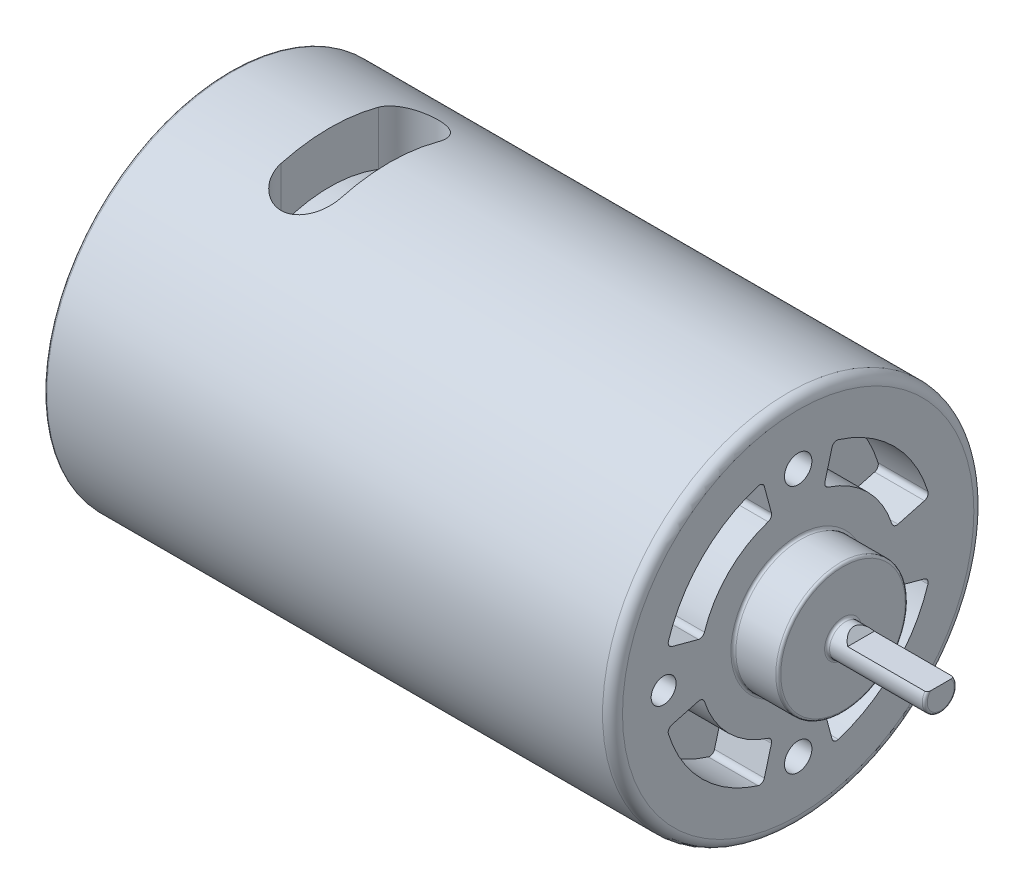
from build123d import *

# Parameters (mm, degrees)
FILLET1_R           = 1
FILLET2_R           = 0.25
CUT_EXTRUDE1_DEPTH  = 8
CUT_EXTRUDE2_DEPTH  = 4
CUT_EXTRUDE3_DEPTH  = 25
CUT_EXTRUDE4_DEPTH  = 5
SKETCH6_R           = 1.375
SKETCH6_R_2         = 1.25
CUT_EXTRUDE5_DEPTH  = 5
SKETCH7_R           = 1.125
CUT_EXTRUDE6_DEPTH  = 5
SKETCH8_W           = 29.9
SKETCH8_H           = 13.5
SKETCH9_W           = 6
SKETCH9_H           = 3
SKETCH9_W_2         = 4
SKETCH9_H_2         = 1
BOSS_EXTRUDE1_DEPTH = 1.25
FILLET3_R           = 0.25


with BuildPart() as part:
    # Sketch1 → Revolve1 (revolve)
    with BuildSketch(Plane.XY):
        Polygon((37.9, 0), (37.9, 1.6), (28.1, 1.6), (28.1, 6.5), (23.6, 6.5), (23.6, 18.625), (-33.4, 18.625), (-33.4, 5.125), (-35.65, 5.125), (-36.4, 4.5), (-36.4, 1.6), (-37.9, 1.6), (-37.9, 0), align=None)
    revolve(axis=Axis((56.332199631, 0, 0), (-1, 0, 0)))

    # Fillet1
    fillet1_edges = [part.edges().sort_by_distance(p)[0] for p in [
        (23.6, -18.625, 0),
    ]]
    fillet(fillet1_edges, radius=FILLET1_R)

    # Fillet2
    fillet2_edges = [part.edges().sort_by_distance(p)[0] for p in [
        (-36.4, -4.5, 0),
        (-35.65, -5.125, 0),
        (-33.4, -18.625, 0),
        (23.6, -6.5, 0),
        (28.1, -6.5, 0),
        (28.1, -1.6, 0),
        (37.9, -1.6, 0),
        (-37.9, -1.6, 0),
        (-36.4, -1.6, 0),
    ]]
    fillet(fillet2_edges, radius=FILLET2_R)

    # Sketch2 → Cut-Extrude1 (cut)
    with BuildSketch(Plane(origin=(37.9, 0, 0), x_dir=(0, 0, -1), z_dir=(1, 0, 0))):
        with BuildLine():
            Line((-1.798436821, 0.875), (1.798436821, 0.875))
            ThreePointArc((1.798436821, 0.875), (0, 2), (-1.798436821, 0.875))
        make_face()
    extrude(amount=-CUT_EXTRUDE1_DEPTH, mode=Mode.SUBTRACT)

    # Sketch3 → Cut-Extrude2 (cut, symmetric)
    with BuildSketch(Plane.XY):
        Polygon((29.9, 0.875), (29.175, 1.6), (29.9, 1.6), align=None)
    extrude(amount=CUT_EXTRUDE2_DEPTH, both=True, mode=Mode.SUBTRACT)

    # Sketch4 → Cut-Extrude3 (cut, symmetric)
    with BuildSketch(Plane(origin=(0, 0, 0), x_dir=(1, 0, 0), z_dir=(0, 1, 0))):
        with BuildLine():
            Line((-23.4, 4.875), (-23.4, -4.875))
            ThreePointArc((-23.4, -4.875), (-20.4, -7.875), (-17.4, -4.875))
            Line((-17.4, -4.875), (-17.4, 4.875))
            ThreePointArc((-17.4, 4.875), (-20.4, 7.875), (-23.4, 4.875))
        make_face()
    extrude(amount=CUT_EXTRUDE3_DEPTH, both=True, mode=Mode.SUBTRACT)

    # Sketch5 → Cut-Extrude4 (cut)
    with BuildSketch(Plane(origin=(23.6, 0, 0), x_dir=(0, 0, -1), z_dir=(1, 0, 0))):
        with BuildLine():
            Line((-3.394534129, 12.668573836), (-2.682127478, 10.009836022))
            ThreePointArc((-2.682127478, 10.009836022), (-2.726177645, 9.640936205), (-3.012555915, 9.404261367))
            ThreePointArc((-3.012555915, 9.404261367), (-6.982679464, 6.982679464), (-9.404261367, 3.012555915))
            ThreePointArc((-9.404261367, 3.012555915), (-9.640936205, 2.726177645), (-10.009836022, 2.682127478))
            Line((-10.009836022, 2.682127478), (-12.668573836, 3.394534129))
            ThreePointArc((-12.668573836, 3.394534129), (-12.976861198, 3.635791772), (-13.016846764, 4.025211215))
            ThreePointArc((-13.016846764, 4.025211215), (-9.634329894, 9.634329894), (-4.025211215, 13.016846764))
            ThreePointArc((-4.025211215, 13.016846764), (-3.635791772, 12.976861198), (-3.394534129, 12.668573836))
        make_face()
        with BuildLine():
            Line((3.394534129, 12.668573836), (2.682127478, 10.009836022))
            ThreePointArc((2.682127478, 10.009836022), (2.726177645, 9.640936205), (3.012555915, 9.404261367))
            ThreePointArc((3.012555915, 9.404261367), (6.982679464, 6.982679464), (9.404261367, 3.012555915))
            ThreePointArc((9.404261367, 3.012555915), (9.640936205, 2.726177645), (10.009836022, 2.682127478))
            Line((10.009836022, 2.682127478), (12.668573836, 3.394534129))
            ThreePointArc((12.668573836, 3.394534129), (12.976861198, 3.635791772), (13.016846764, 4.025211215))
            ThreePointArc((13.016846764, 4.025211215), (9.634329894, 9.634329894), (4.025211215, 13.016846764))
            ThreePointArc((4.025211215, 13.016846764), (3.635791772, 12.976861198), (3.394534129, 12.668573836))
        make_face()
        with BuildLine():
            Line((10.009836022, -2.682127478), (12.668573836, -3.394534129))
            ThreePointArc((12.668573836, -3.394534129), (12.976861198, -3.635791772), (13.016846764, -4.025211215))
            ThreePointArc((13.016846764, -4.025211215), (9.634329894, -9.634329894), (4.025211215, -13.016846764))
            ThreePointArc((4.025211215, -13.016846764), (3.635791772, -12.976861198), (3.394534129, -12.668573836))
            Line((3.394534129, -12.668573836), (2.682127478, -10.009836022))
            ThreePointArc((2.682127478, -10.009836022), (2.726177645, -9.640936205), (3.012555915, -9.404261367))
            ThreePointArc((3.012555915, -9.404261367), (6.982679464, -6.982679464), (9.404261367, -3.012555915))
            ThreePointArc((9.404261367, -3.012555915), (9.640936205, -2.726177645), (10.009836022, -2.682127478))
        make_face()
        with BuildLine():
            Line((-2.682127478, -10.009836022), (-3.394534129, -12.668573836))
            ThreePointArc((-3.394534129, -12.668573836), (-3.635791772, -12.976861198), (-4.025211215, -13.016846764))
            ThreePointArc((-4.025211215, -13.016846764), (-9.634329894, -9.634329894), (-13.016846764, -4.025211215))
            ThreePointArc((-13.016846764, -4.025211215), (-12.976861198, -3.635791772), (-12.668573836, -3.394534129))
            Line((-12.668573836, -3.394534129), (-10.009836022, -2.682127478))
            ThreePointArc((-10.009836022, -2.682127478), (-9.640936205, -2.726177645), (-9.404261367, -3.012555915))
            ThreePointArc((-9.404261367, -3.012555915), (-6.982679464, -6.982679464), (-3.012555915, -9.404261367))
            ThreePointArc((-3.012555915, -9.404261367), (-2.726177645, -9.640936205), (-2.682127478, -10.009836022))
        make_face()
    extrude(amount=-CUT_EXTRUDE4_DEPTH, mode=Mode.SUBTRACT)

    # Sketch6 → Cut-Extrude5 (cut)
    with BuildSketch(Plane(origin=(23.6, 0, 0), x_dir=(0, 0, -1), z_dir=(1, 0, 0))):
        with Locations(Location((0, 12.5, 0), (0, 0, 90))):
            Circle(SKETCH6_R)
        with Locations(Location((0, -12.5, 0), (0, 0, 90))):
            Circle(SKETCH6_R)
        with Locations(Location((-13.5, 0, 0), (0, 0, 90))):
            Circle(SKETCH6_R_2)
    extrude(amount=-CUT_EXTRUDE5_DEPTH, mode=Mode.SUBTRACT)

    # Sketch7 → Cut-Extrude6 (cut)
    with BuildSketch(Plane.ZY.offset(33.4)):
        with Locations(Location((-9, 0, 0), (0, 0, 270))):
            Circle(SKETCH7_R)
        with Locations(Location((9, 0, 0), (0, 0, 270))):
            Circle(SKETCH7_R)
        with BuildLine():
            Line((-1.690842008, 9.58924154), (-1.429964012, 8.109728906))
            ThreePointArc((-1.429964012, 8.109728906), (-1.504285586, 7.748665527), (-1.805860744, 7.536668161))
            ThreePointArc((-1.805860744, 7.536668161), (-4.981603975, 5.936844434), (-7.10858481, 3.087154353))
            ThreePointArc((-7.10858481, 3.087154353), (-7.369729436, 2.826973756), (-7.738213256, 2.816479292))
            Line((-7.738213256, 2.816479292), (-9.14994778, 3.330308637))
            ThreePointArc((-9.14994778, 3.330308637), (-9.43736248, 3.600538492), (-9.439396053, 3.995034688))
            ThreePointArc((-9.439396053, 3.995034688), (-6.588572999, 7.851955542), (-2.295207212, 9.98972091))
            ThreePointArc((-2.295207212, 9.98972091), (-1.907057426, 9.919214686), (-1.690842008, 9.58924154))
        make_face()
        with BuildLine():
            Line((1.690842008, 9.58924154), (1.429964012, 8.109728906))
            ThreePointArc((1.429964012, 8.109728906), (1.504285586, 7.748665527), (1.805860744, 7.536668161))
            ThreePointArc((1.805860744, 7.536668161), (4.981603975, 5.936844434), (7.10858481, 3.087154353))
            ThreePointArc((7.10858481, 3.087154353), (7.369729436, 2.826973756), (7.738213256, 2.816479292))
            Line((7.738213256, 2.816479292), (9.14994778, 3.330308637))
            ThreePointArc((9.14994778, 3.330308637), (9.43736248, 3.600538492), (9.439396053, 3.995034688))
            ThreePointArc((9.439396053, 3.995034688), (6.588572999, 7.851955542), (2.295207212, 9.98972091))
            ThreePointArc((2.295207212, 9.98972091), (1.907057426, 9.919214686), (1.690842008, 9.58924154))
        make_face()
        with BuildLine():
            Line((9.14994778, -3.330308637), (7.738213256, -2.816479292))
            ThreePointArc((7.738213256, -2.816479292), (7.369729436, -2.826973756), (7.10858481, -3.087154353))
            ThreePointArc((7.10858481, -3.087154353), (4.981603975, -5.936844434), (1.805860744, -7.536668161))
            ThreePointArc((1.805860744, -7.536668161), (1.504285586, -7.748665527), (1.429964012, -8.109728906))
            Line((1.429964012, -8.109728906), (1.690842008, -9.58924154))
            ThreePointArc((1.690842008, -9.58924154), (1.907057426, -9.919214686), (2.295207212, -9.98972091))
            ThreePointArc((2.295207212, -9.98972091), (6.588572999, -7.851955542), (9.439396053, -3.995034688))
            ThreePointArc((9.439396053, -3.995034688), (9.43736248, -3.600538492), (9.14994778, -3.330308637))
        make_face()
        with BuildLine():
            Line((-1.429964012, -8.109728906), (-1.690842008, -9.58924154))
            ThreePointArc((-1.690842008, -9.58924154), (-1.907057426, -9.919214686), (-2.295207212, -9.98972091))
            ThreePointArc((-2.295207212, -9.98972091), (-6.588572999, -7.851955542), (-9.439396053, -3.995034688))
            ThreePointArc((-9.439396053, -3.995034688), (-9.43736248, -3.600538492), (-9.14994778, -3.330308637))
            Line((-9.14994778, -3.330308637), (-7.738213256, -2.816479292))
            ThreePointArc((-7.738213256, -2.816479292), (-7.369729436, -2.826973756), (-7.10858481, -3.087154353))
            ThreePointArc((-7.10858481, -3.087154353), (-4.981603975, -5.936844434), (-1.805860744, -7.536668161))
            ThreePointArc((-1.805860744, -7.536668161), (-1.504285586, -7.748665527), (-1.429964012, -8.109728906))
        make_face()
    extrude(amount=-CUT_EXTRUDE6_DEPTH, mode=Mode.SUBTRACT)

    # Sketch8 → Revolve2 (revolve)
    with BuildSketch(Plane.XY, mode=Mode.PRIVATE) as revolve2_sk:
        with Locations((-14.95, 6.75)):
            Rectangle(SKETCH8_W, SKETCH8_H)
    revolve(revolve2_sk.sketch.rotate(Axis((0, 0, 0), (-1, 0, 0)), 180), axis=Axis((0, 0, 0), (-1, 0, 0)))

    # Sketch9 → Boss-Extrude1 (add)
    # profile 1 of 2: a face of its own
    with BuildSketch(Plane.ZY.offset(33.4)):
        with Locations((0, 14.25)):
            Rectangle(SKETCH9_W, SKETCH9_H)
        with Locations((0, 14.25)):
            Rectangle(SKETCH9_W_2, SKETCH9_H_2, mode=Mode.SUBTRACT)
    # profile 2 of 2: a face of its own
    with BuildSketch(Plane.ZY.offset(33.4)):
        with Locations((0, -14.25)):
            Rectangle(SKETCH9_W, SKETCH9_H)
        with Locations((0, -14.25)):
            Rectangle(SKETCH9_W_2, SKETCH9_H_2, mode=Mode.SUBTRACT)
    extrude(amount=BOSS_EXTRUDE1_DEPTH)

    # Fillet3
    fillet3_edges = [part.edges().sort_by_distance(p)[0] for p in [
        (-34.65, 14.25, 3),
        (-34.65, 15.75, 0),
        (-34.65, 14.25, -3),
        (-34.65, 12.75, 0),
        (-34.65, -14.25, 3),
        (-34.65, -12.75, 0),
        (-34.65, -14.25, -3),
        (-34.65, -15.75, 0),
    ]]
    fillet(fillet3_edges, radius=FILLET3_R)


solid = part.part
